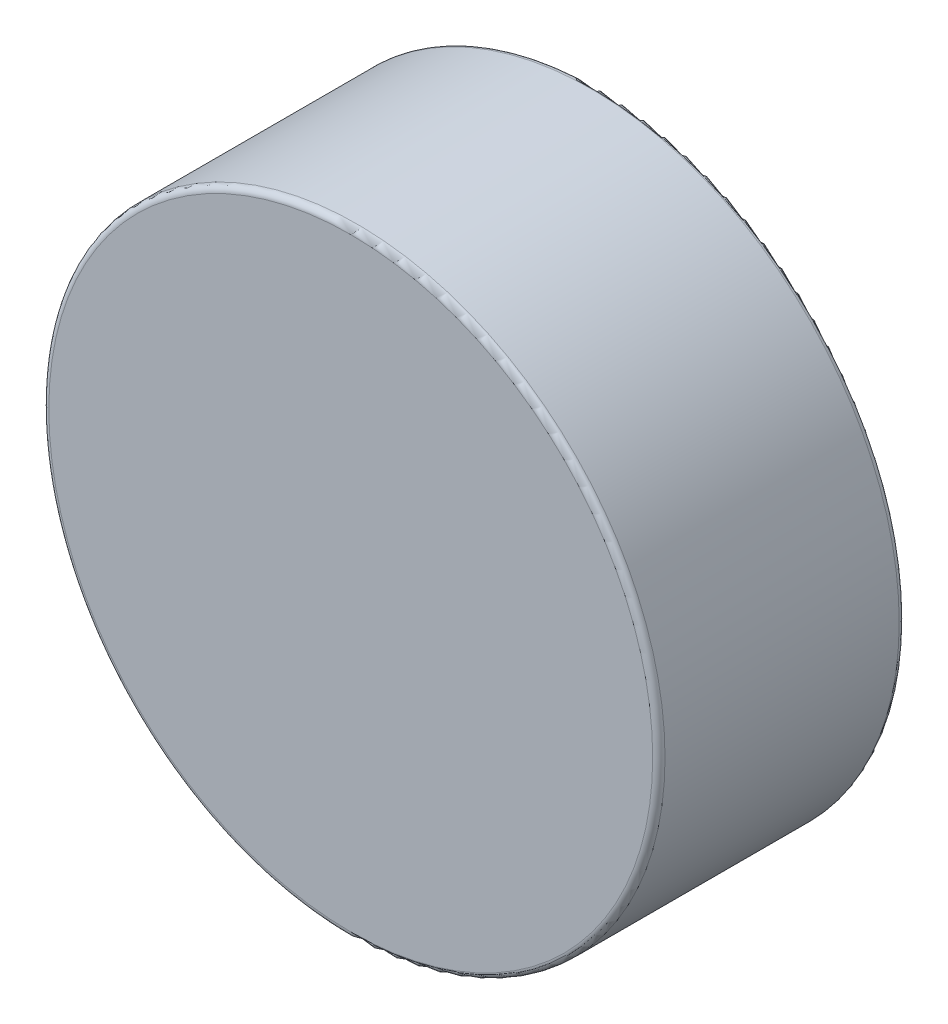
from build123d import *

# Parameters (mm, degrees)
BOSS_EXTRUDE1_DEPTH      = 1.5875
BOSS_EXTRUDE1_DEPTH_BACK = 1.5875
SKETCH3_R                = 3.96875
FILLET1_R                = 0.079375


with BuildPart() as part:
    # Sketch3 → Boss-Extrude1 (new, two sides: drawn at the far end of the back side and taken through both)
    with BuildSketch(Plane.XY.offset(-BOSS_EXTRUDE1_DEPTH_BACK)):
        Circle(SKETCH3_R)
    extrude(amount=BOSS_EXTRUDE1_DEPTH + BOSS_EXTRUDE1_DEPTH_BACK)

    # Fillet1
    fillet1_edges = [part.edges().sort_by_distance(p)[0] for p in [
        (-3.96875, 0, -1.5875),
        (-3.96875, 0, 1.5875),
    ]]
    fillet(fillet1_edges, radius=FILLET1_R)


solid = part.part
